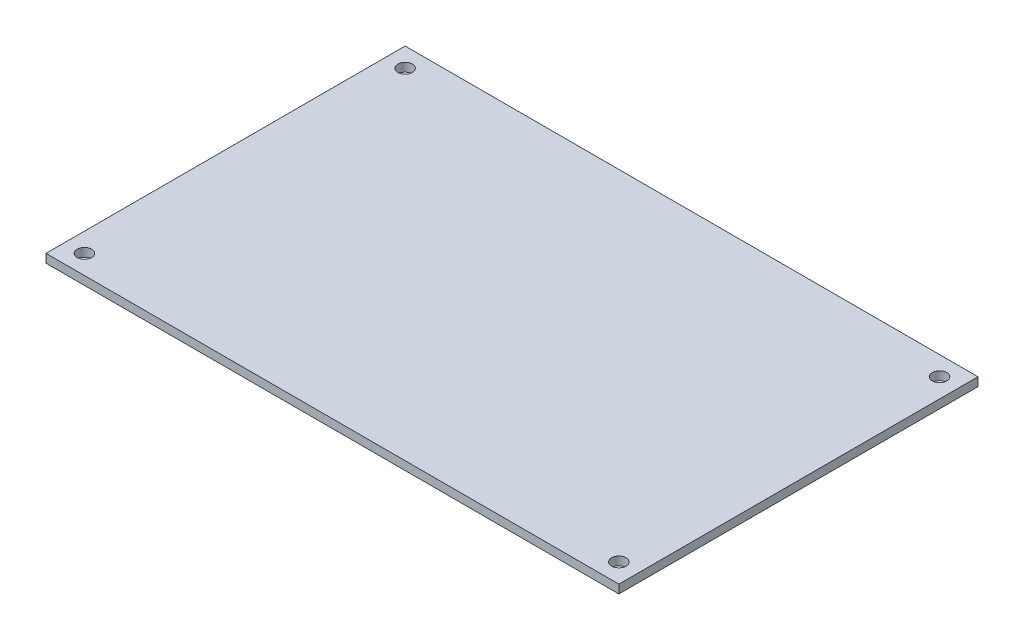
from build123d import *

# Parameters (mm, degrees)
SKETCH1_W                = 134
SKETCH1_H                = 84
BOSS_EXTRUDE1_DEPTH      = 2
M3_CLEARANCE_HOLE1_D     = 3.4
M3_CLEARANCE_HOLE1_DEPTH = 5
M3_CLEARANCE_HOLE1_TIP   = 1.021463052


with BuildPart() as part:
    # Sketch1 → Boss-Extrude1 (new body)
    with BuildSketch(Plane(origin=(0, 0, 0), x_dir=(1, 0, 0), z_dir=(0, 1, 0))):
        with Locations((67, 42)):
            Rectangle(SKETCH1_W, SKETCH1_H)
    extrude(amount=BOSS_EXTRUDE1_DEPTH)

    # M3 Clearance Hole1
    with Locations(Plane(origin=(0, 2, 0), x_dir=(1, 0, 0), z_dir=(0, 1, 0))):
        with Locations((4.5, 79.5), (129.5, 79.5), (129.5, 4.5), (4.5, 4.5)):
            Hole(M3_CLEARANCE_HOLE1_D / 2, depth=M3_CLEARANCE_HOLE1_DEPTH)
            with Locations((0, 0, -(M3_CLEARANCE_HOLE1_DEPTH + M3_CLEARANCE_HOLE1_TIP / 2))):  # 118° drill point
                Cone(0, M3_CLEARANCE_HOLE1_D / 2, M3_CLEARANCE_HOLE1_TIP, mode=Mode.SUBTRACT)


solid = part.part
